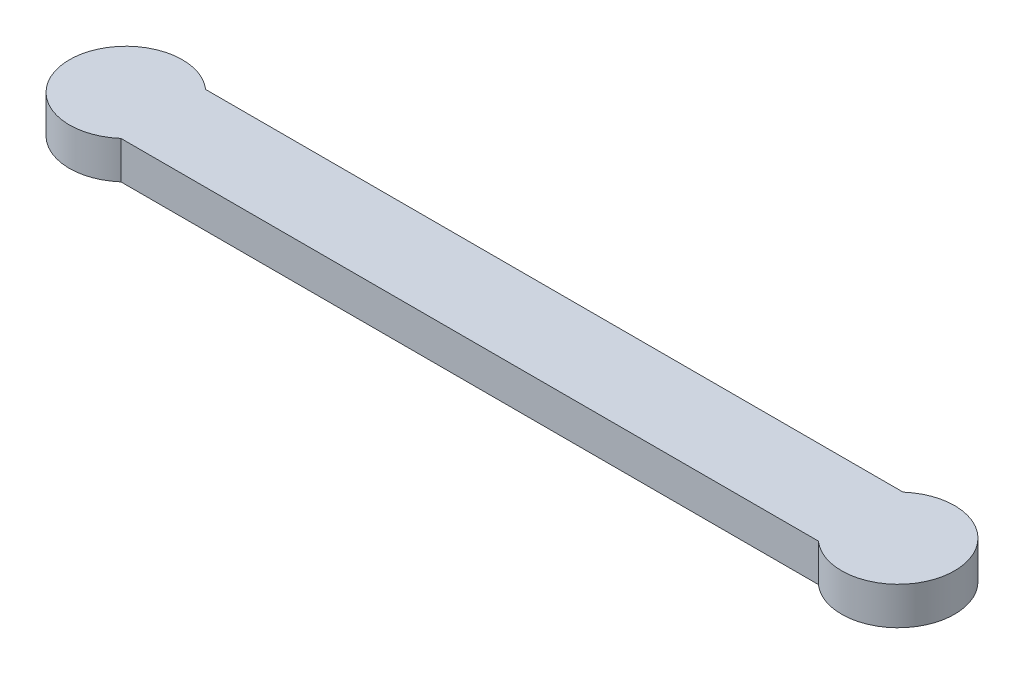
from build123d import *

# Parameters (mm, degrees)
SKETCH_1_R      = 6
EXTRUDE_1_DEPTH = 4


with BuildPart() as part:
    # 草图1 → 凸台-拉伸1 (new body)
    with BuildSketch(Plane(origin=(0, 0, 0), x_dir=(1, 0, 0), z_dir=(0, 1, 0))):
        Circle(SKETCH_1_R)
        with Locations((82, 0)):
            Circle(SKETCH_1_R)
        with BuildLine():
            Line((0, 4.5), (82, 4.5))
            ThreePointArc((82, 4.5), (86.5, 0), (82, -4.5))
            Line((82, -4.5), (0, -4.5))
            ThreePointArc((0, -4.5), (-4.5, 0), (0, 4.5))
        make_face()
    extrude(amount=EXTRUDE_1_DEPTH)


solid = part.part
